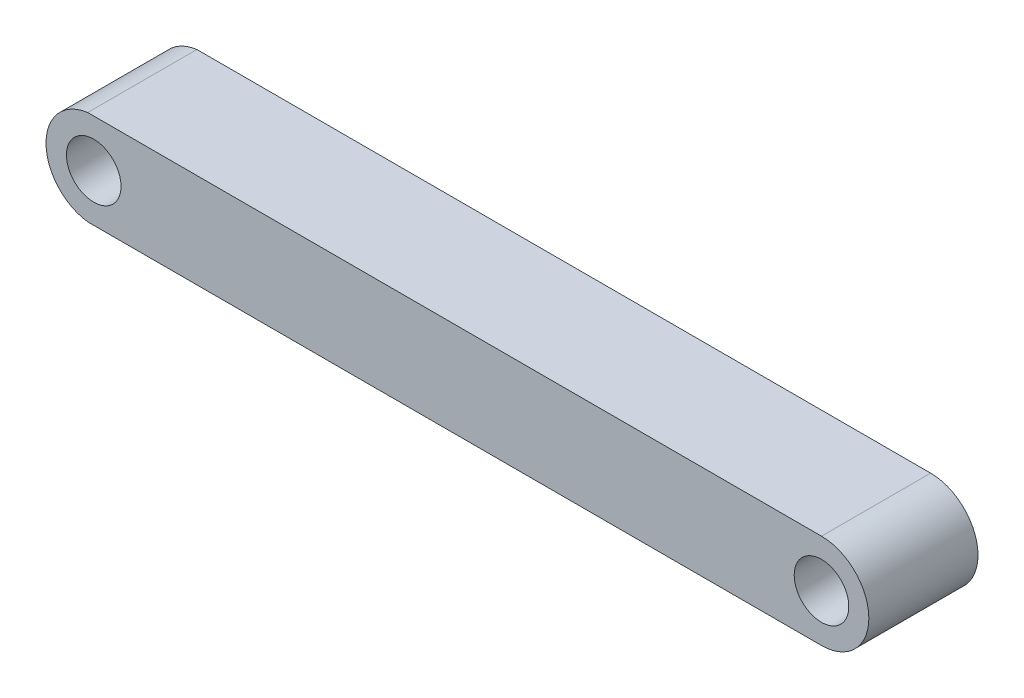
from build123d import *

# Parameters (mm, degrees)
SKETCH1_R           = 4.7625
BOSS_EXTRUDE1_DEPTH = 19.05


with BuildPart() as part:
    # Sketch1 → Boss-Extrude1 (new body)
    with BuildSketch(Plane.XY):
        with BuildLine():
            Line((-21.299732353, 8.583841329), (106.749067745, 8.583841329))
            ThreePointArc((106.749067745, 8.583841329), (115.013167133, 0.319741941), (106.749067745, -7.944357448))
            Line((106.749067745, -7.944357448), (-21.299732353, -7.944357448))
            ThreePointArc((-21.299732353, -7.944357448), (-28.581317621, 0.319741941), (-21.299732353, 8.583841329))
        make_face()
        with Locations(Location((-20.250932255, 0.319741941, 0), (0, 0, 180))):
            Circle(SKETCH1_R, mode=Mode.SUBTRACT)
        with Locations(Location((106.749067745, 0.319741941, 0), (0, 0, 180))):
            Circle(SKETCH1_R, mode=Mode.SUBTRACT)
    extrude(amount=BOSS_EXTRUDE1_DEPTH)


solid = part.part
